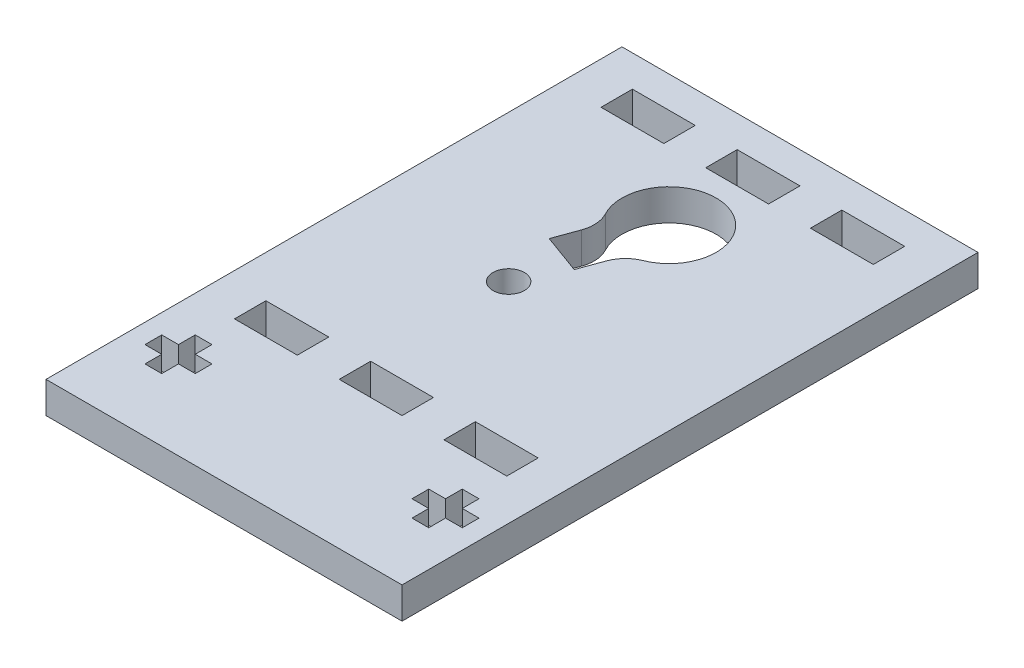
from build123d import *

# Parameters (mm, degrees)
SKETCH1_W            = 34
SKETCH1_H            = 55
BOSS_EXTRUDE1_DEPTH  = 3
SKETCH2_R            = 1.5
CUT_EXTRUDE1_DEPTH   = 3
CUT_EXTRUDE4_DEPTH   = 3
LPATTERN1_COUNT      = 2
LPATTERN1_PITCH      = 25.5
SKETCH5_W            = 6
SKETCH5_H            = 3
CUT_EXTRUDE5_DEPTH   = 3
LPATTERN2_COUNT      = 3
LPATTERN2_PITCH      = 10
LPATTERN2_COUNT_DIR2 = 2
LPATTERN2_PITCH_DIR2 = 35
SKETCH6_R            = 4.5
CUT_EXTRUDE6_DEPTH   = 3
CUT_EXTRUDE7_DEPTH   = 3
FILLET9_R            = 3
FILLET10_R           = 3


with BuildPart() as part:
    # Sketch1 → Boss-Extrude1 (new body)
    with BuildSketch(Plane(origin=(0, 0, 0), x_dir=(1, 0, 0), z_dir=(0, 1, 0))):
        Rectangle(SKETCH1_W, SKETCH1_H)
    extrude(amount=BOSS_EXTRUDE1_DEPTH)

    # Sketch2 → Cut-Extrude1 (cut)
    with BuildSketch(Plane(origin=(0, 3, 0), x_dir=(1, 0, 0), z_dir=(0, 1, 0))):
        with Locations(Location((-3, 2.680652708, 0), (0, 0, 270))):
            Circle(SKETCH2_R)
    extrude(amount=-CUT_EXTRUDE1_DEPTH, mode=Mode.SUBTRACT)

    # Sketch4 → Cut-Extrude4 (cut)
    with BuildSketch(Plane(origin=(0, 3, 0), x_dir=(1, 0, 0), z_dir=(0, 1, 0))):
        Polygon((-13.55, -16.7), (-11.95, -16.7), (-11.95, -18.3), (-10.35, -18.3), (-10.35, -19.9), (-11.95, -19.9), (-11.95, -21.5), (-13.55, -21.5), (-13.55, -19.9), (-15.15, -19.9), (-15.15, -18.3), (-13.55, -18.3), align=None)
    cut_extrude4 = extrude(amount=-CUT_EXTRUDE4_DEPTH, mode=Mode.SUBTRACT)

    # LPattern1: Cut-Extrude4 ×2
    with Locations(*[(i * LPATTERN1_PITCH, 0, 0) for i in range(1, LPATTERN1_COUNT)]):
        add(cut_extrude4, mode=Mode.SUBTRACT)

    # Sketch5 → Cut-Extrude5 (cut)
    with BuildSketch(Plane(origin=(0, 3, 0), x_dir=(1, 0, 0), z_dir=(0, 1, 0))):
        with Locations((-10, 23)):
            Rectangle(SKETCH5_W, SKETCH5_H)
    cut_extrude5 = extrude(amount=-CUT_EXTRUDE5_DEPTH, mode=Mode.SUBTRACT)

    # LPattern2: Cut-Extrude5 3 × 2
    with Locations(*[(i * LPATTERN2_PITCH, 0, j * LPATTERN2_PITCH_DIR2) for i in range(LPATTERN2_COUNT) for j in range(LPATTERN2_COUNT_DIR2) if (i, j) != (0, 0)]):
        add(cut_extrude5, mode=Mode.SUBTRACT)

    # Sketch6 → Cut-Extrude6 (cut)
    with BuildSketch(Plane(origin=(0, 3, 0), x_dir=(1, 0, 0), z_dir=(0, 1, 0))):
        with Locations(Location((0, 15, 0), (0, 0, 270))):
            Circle(SKETCH6_R)
    extrude(amount=-CUT_EXTRUDE6_DEPTH, mode=Mode.SUBTRACT)

    # Sketch8 → Cut-Extrude7 (cut)
    with BuildSketch(Plane(origin=(0, 3, 0), x_dir=(1, 0, 0), z_dir=(0, 1, 0))):
        Polygon((0.853324812, 11.496881851), (-2.905445672, 12.864962424), (-4.615546388, 8.16649932), (-0.856775905, 6.798418747), align=None)
    extrude(amount=-CUT_EXTRUDE7_DEPTH, mode=Mode.SUBTRACT)

    # Fillet9
    fillet9_edges = [part.edges().sort_by_distance(p)[0] for p in [
        (-3.258112517, 1.5, -11.89601823),
    ]]
    fillet(fillet9_edges, radius=FILLET9_R)

    # Fillet10
    fillet10_edges = [part.edges().sort_by_distance(p)[0] for p in [
        (0.500657966, 1.5, -10.527937657),
    ]]
    fillet(fillet10_edges, radius=FILLET10_R)


solid = part.part
